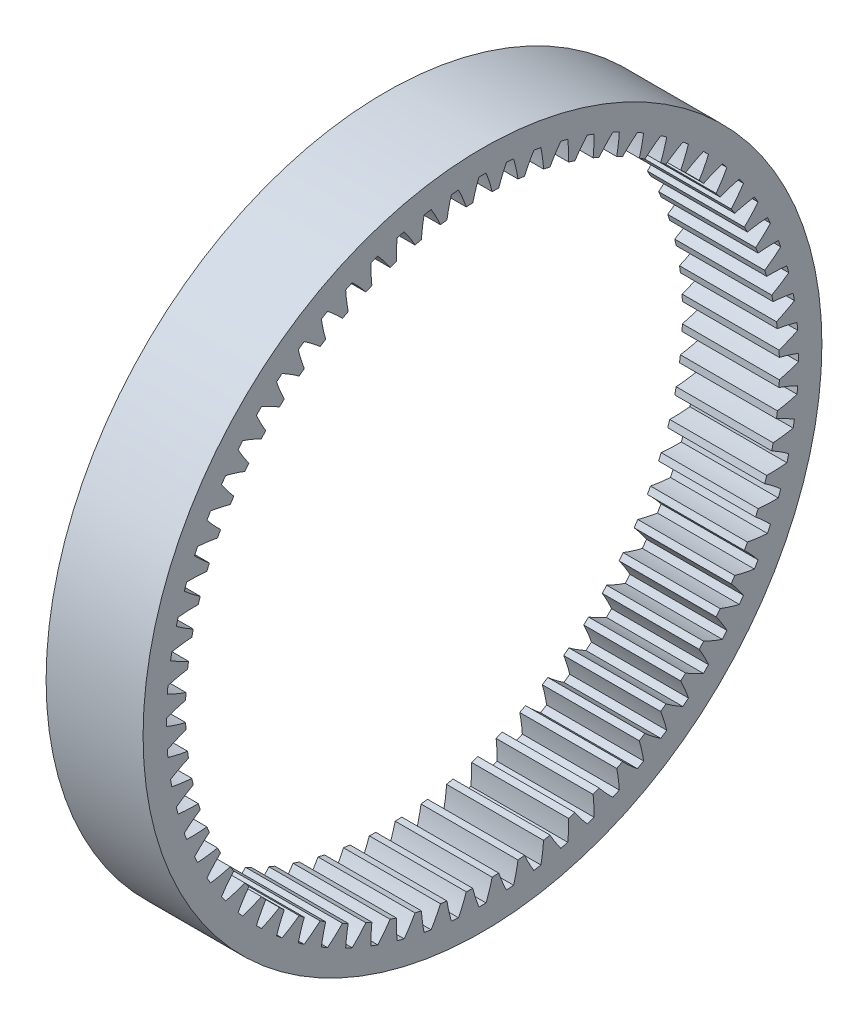
from build123d import *

# Parameters (mm, degrees)
BASPROSKE_W     = 20
BASPROSKE_H     = 8.75
TOOTHCUT_DEPTH  = 101.995049384
TEETHCUTS_COUNT = 72
TEETHCUTS_ANGLE = 355


with BuildPart() as part:
    # BasProSke → Base-Revolve (revolve)
    with BuildSketch(Plane(origin=(0, 0, 0), x_dir=(1, 0, 0), z_dir=(0, 1, 0)), mode=Mode.PRIVATE) as base_revolve_sk:
        with Locations((10, 65.625)):
            Rectangle(BASPROSKE_W, BASPROSKE_H)
    revolve(base_revolve_sk.sketch.rotate(Axis((-10, 0, 0), (1, 0, 0)), 180), axis=Axis((-10, 0, 0), (1, 0, 0)))

    # TooCutSke → ToothCut (cut, through all)
    with BuildSketch(Plane(origin=(0, 0, 0), x_dir=(0, 0, -1), z_dir=(1, 0, 0))):
        with BuildLine():
            ThreePointArc((2.001674172, 61.191869931), (1.435831901, 63.209139262), (0.737142951, 65.184332109))
            ThreePointArc((0.737142951, 65.184332109), (0, 65.1885), (-0.737142951, 65.184332109))
            ThreePointArc((-0.737142951, 65.184332109), (-1.435831901, 63.209139262), (-2.001674172, 61.191869931))
            ThreePointArc((-2.001674172, 61.191869931), (0, 61.2246), (2.001674172, 61.191869931))
        make_face()
    toothcut = extrude(amount=TOOTHCUT_DEPTH, mode=Mode.SUBTRACT)

    # TeethCuts: ToothCut ×72 about axis
    teethcuts_axis = Axis((-10, 0, 0), (1, 0, 0))
    for i in range(1, TEETHCUTS_COUNT):
        add(toothcut.rotate(teethcuts_axis, i * TEETHCUTS_ANGLE / (TEETHCUTS_COUNT - 1)), mode=Mode.SUBTRACT)


solid = part.part
